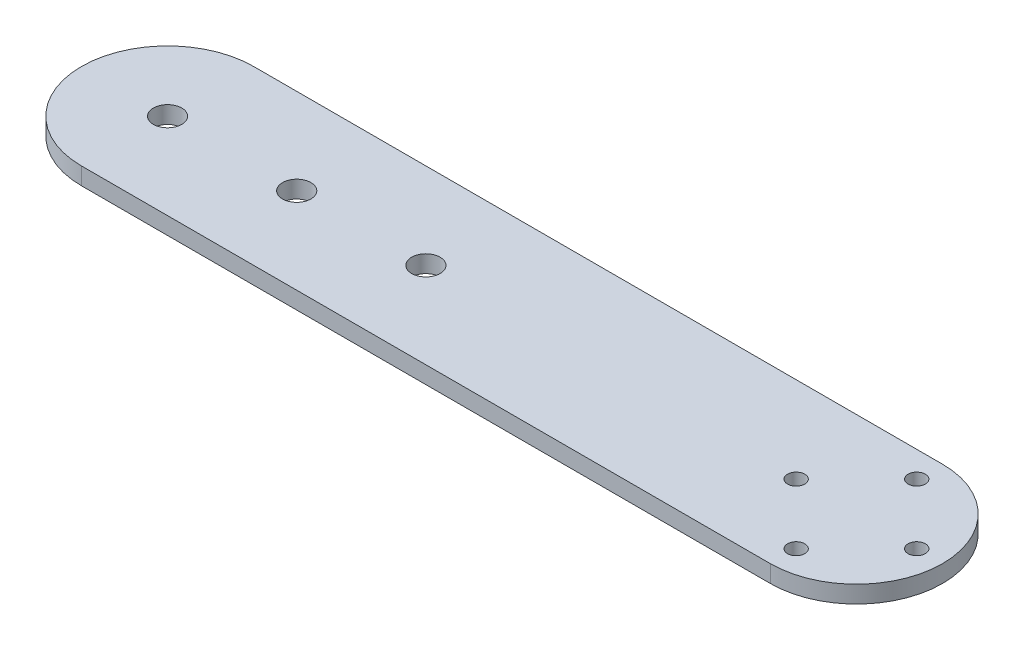
from build123d import *

# Parameters (mm, degrees)
SKETCH_1_R      = 1.65
SKETCH_1_R_2    = 1
EXTRUDE_1_DEPTH = 2


with BuildPart() as part:
    # Эскиз1 → Бобышка-Вытянуть1 (new body)
    with BuildSketch(Plane(origin=(0, 0, 0), x_dir=(1, 0, 0), z_dir=(0, 1, 0))):
        with BuildLine():
            Line((0, 10), (80, 10))
            ThreePointArc((80, 10), (90, 0), (80, -10))
            Line((80, -10), (0, -10))
            ThreePointArc((0, -10), (-10, 0), (0, 10))
        make_face()
        with Locations(Location((30, 0, 0), (0, 0, 270))):
            Circle(SKETCH_1_R, mode=Mode.SUBTRACT)
        with Locations(Location((0, 0, 0), (0, 0, 270))):
            Circle(SKETCH_1_R, mode=Mode.SUBTRACT)
        with Locations(Location((15, 0, 0), (0, 0, 270))):
            Circle(SKETCH_1_R, mode=Mode.SUBTRACT)
        with Locations(Location((80, 7, 0), (0, 0, 270))):
            Circle(SKETCH_1_R_2, mode=Mode.SUBTRACT)
        with Locations(Location((87, 0, 0), (0, 0, 270))):
            Circle(SKETCH_1_R_2, mode=Mode.SUBTRACT)
        with Locations(Location((73, 0, 0), (0, 0, 270))):
            Circle(SKETCH_1_R_2, mode=Mode.SUBTRACT)
        with Locations(Location((80, -7, 0), (0, 0, 270))):
            Circle(SKETCH_1_R_2, mode=Mode.SUBTRACT)
    extrude(amount=EXTRUDE_1_DEPTH)


solid = part.part
